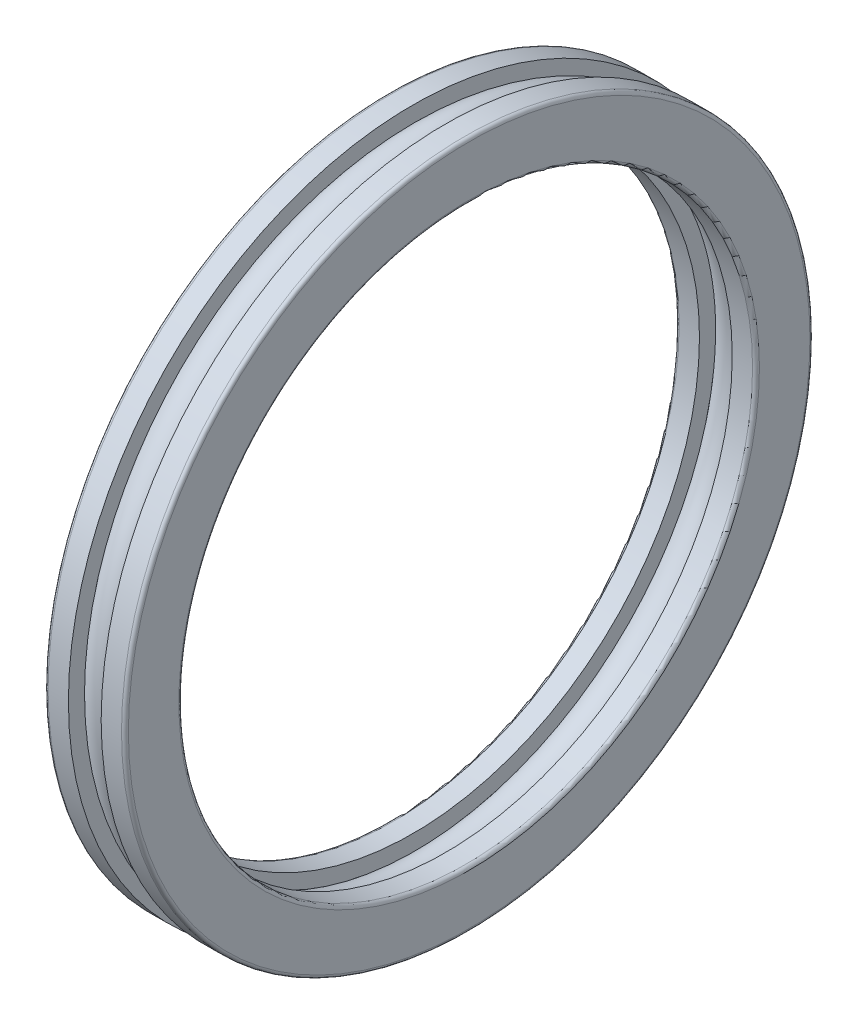
from build123d import *

# Parameters (mm, degrees)
BALSIMSKE_R = 3.57


with BuildPart() as part:
    # InnRacSke → Race (revolve)
    with BuildSketch(Plane.XY, mode=Mode.PRIVATE) as race_sk:
        with BuildLine():
            Line((-2.856, 52.899931192), (-2.856, 50))
            Line((-2.856, 50), (-6.4, 50))
            ThreePointArc((-6.4, 50), (-6.824264069, 50.175735931), (-7, 50.6))
            Line((-7, 50.6), (-7, 59.4))
            ThreePointArc((-7, 59.4), (-6.824264069, 59.824264069), (-6.4, 60))
            Line((-6.4, 60), (-2.856, 60))
            Line((-2.856, 60), (-2.856, 57.100068808))
            ThreePointArc((-2.856, 57.100068808), (-3.545, 55), (-2.856, 52.899931192))
        make_face()
    race = revolve(race_sk.sketch.rotate(Axis((-34.925, 0, 0), (1, 0, 0)), 270), axis=Axis((-34.925, 0, 0), (1, 0, 0)))

    # BalSimSke → BallsSimplified (revolve)
    with BuildSketch(Plane.XY, mode=Mode.PRIVATE) as ballssimplified_sk:
        with Locations((0, 55)):
            Circle(BALSIMSKE_R)
    revolve(ballssimplified_sk.sketch.rotate(Axis((-25.4, 0, 0), (1, 0, 0)), 90), axis=Axis((-25.4, 0, 0), (1, 0, 0)))

    # Mirror1: Race across plane
    add(race.mirror(Plane(origin=(0, 0, 0), x_dir=(0, 0, 1), z_dir=(1, 0, 0))))


solid = part.part
